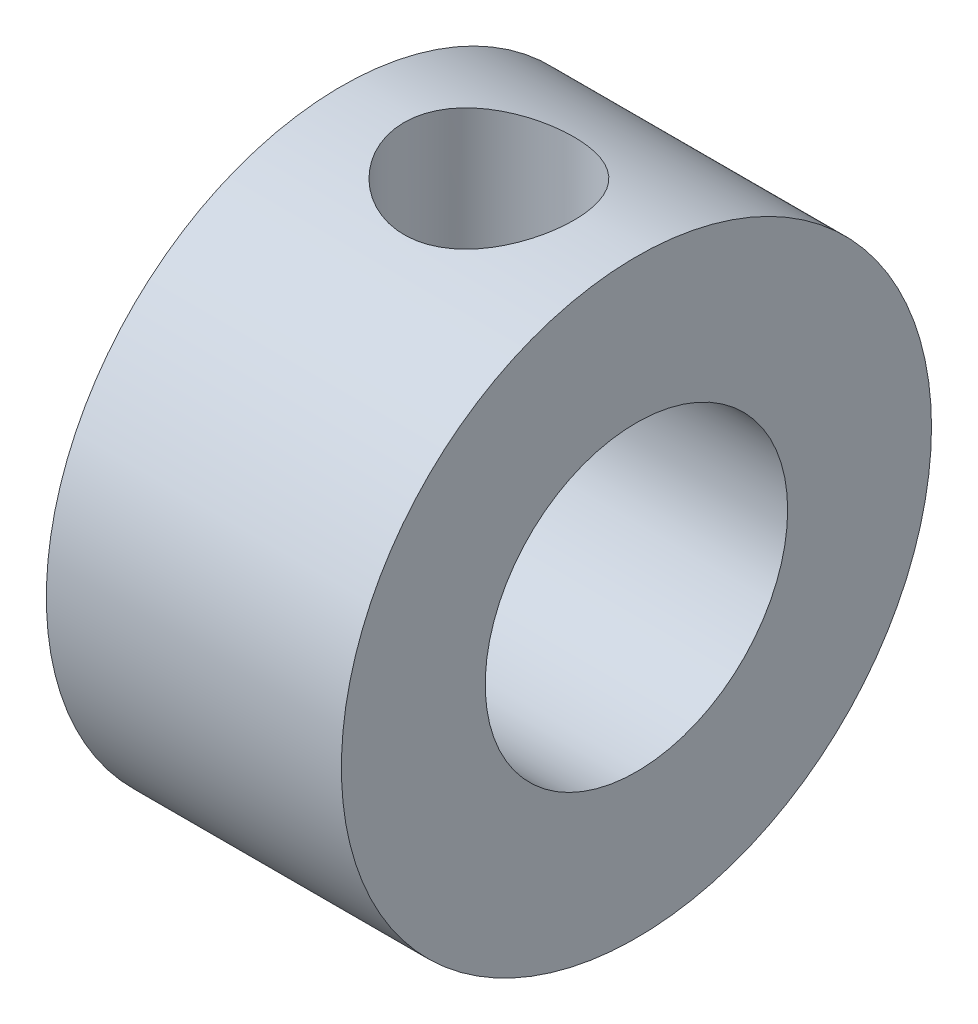
from build123d import *

# Parameters (mm, degrees)
SKETCH_1_R          = 4
SKETCH_1_R_2        = 2.05
EXTRUDE_1_DEPTH     = 4
SKETCH_2_R          = 1.15
CUT_EXTRUDE_1_DEPTH = 5


with BuildPart() as part:
    # 草图1 → 凸台-拉伸1 (new body)
    with BuildSketch(Plane(origin=(0, 0, 0), x_dir=(0, 0, -1), z_dir=(1, 0, 0))):
        Circle(SKETCH_1_R)
        Circle(SKETCH_1_R_2, mode=Mode.SUBTRACT)
    extrude(amount=EXTRUDE_1_DEPTH)

    # 草图2 → 切除-拉伸1 (cut)
    with BuildSketch(Plane(origin=(0, 0, 0), x_dir=(1, 0, 0), z_dir=(0, 1, 0))):
        with Locations(Location((2, 0, 0), (0, 0, 90))):
            Circle(SKETCH_2_R)
    extrude(amount=CUT_EXTRUDE_1_DEPTH, mode=Mode.SUBTRACT)


solid = part.part
